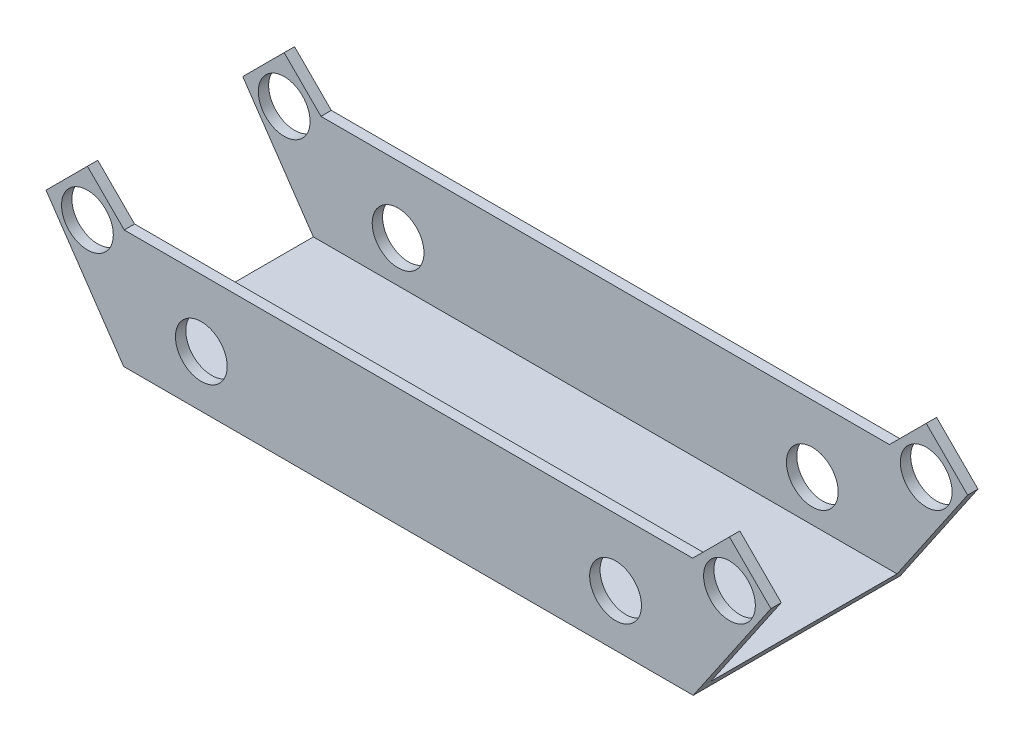
from build123d import *

# Parameters (mm, degrees)
SKETCH1_W           = 140
SKETCH1_H           = 40
BOSS_EXTRUDE1_DEPTH = 30
SKETCH2_W           = 36
SKETCH2_H           = 28
CUT_EXTRUDE1_DEPTH  = 149.660687473
CUT_EXTRUDE2_DEPTH  = 149.660687473
CUT_EXTRUDE3_DEPTH  = 149.660687473
SKETCH6_R           = 5
CUT_EXTRUDE6_DEPTH  = 149.660687473


with BuildPart() as part:
    # Sketch1 → Boss-Extrude1 (new body)
    with BuildSketch(Plane(origin=(0, 0, 0), x_dir=(1, 0, 0), z_dir=(0, 1, 0))):
        with Locations((70, 20)):
            Rectangle(SKETCH1_W, SKETCH1_H)
    extrude(amount=BOSS_EXTRUDE1_DEPTH)

    # Sketch2 → Cut-Extrude1 (cut, through all)
    with BuildSketch(Plane(origin=(140, 0, 0), x_dir=(0, 0, -1), z_dir=(1, 0, 0))):
        with Locations((20, 16)):
            Rectangle(SKETCH2_W, SKETCH2_H)
    extrude(amount=-CUT_EXTRUDE1_DEPTH, mode=Mode.SUBTRACT)

    # Sketch3 → Cut-Extrude2 (cut, through all)
    with BuildSketch(Plane.XY):
        Polygon((0, 0), (15, 0), (0, 22), align=None)
        Polygon((140, 22), (125, 0), (140, 0), align=None)
    extrude(amount=-CUT_EXTRUDE2_DEPTH, mode=Mode.SUBTRACT)

    # Sketch5 → Cut-Extrude3 (cut, through all)
    with BuildSketch(Plane.XY):
        Polygon((0, 30), (0, 22), (8, 30), align=None)
        Polygon((140, 30), (132, 30), (140, 22), align=None)
    extrude(amount=-CUT_EXTRUDE3_DEPTH, mode=Mode.SUBTRACT)

    # Sketch6 → Cut-Extrude6 (cut, through all)
    with BuildSketch(Plane.XY):
        Polygon((70, 30), (8, 30), (15.107268728, 22.892731272), (70, 22.892731272), align=None)
        Polygon((132, 30), (70, 30), (70, 22.892731272), (124.892731272, 22.892731272), align=None)
        with Locations((132, 21)):
            Circle(SKETCH6_R)
        with Locations((110, 10)):
            Circle(SKETCH6_R)
        with Locations((30, 10)):
            Circle(SKETCH6_R)
        with Locations((8, 21)):
            Circle(SKETCH6_R)
    extrude(amount=-CUT_EXTRUDE6_DEPTH, mode=Mode.SUBTRACT)


solid = part.part
